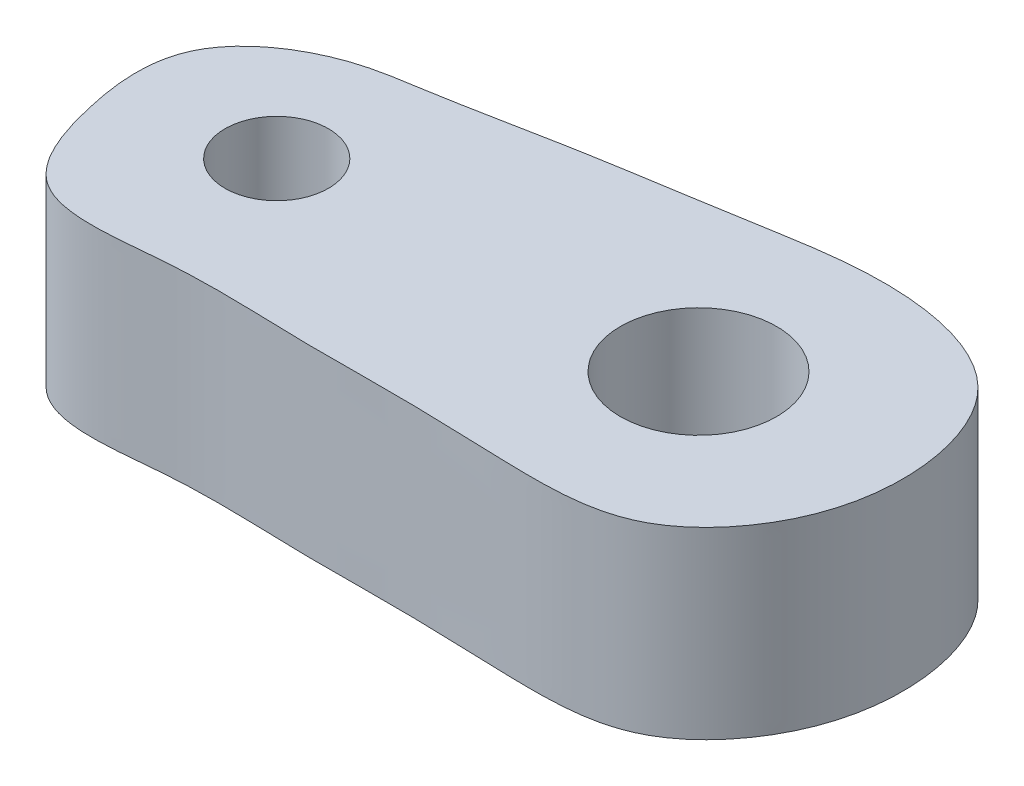
from build123d import *

# Parameters (mm, degrees)
SKETCH1_R           = 1.7
SKETCH1_R_2         = 1.125
BOSS_EXTRUDE4_DEPTH = 4


with BuildPart() as part:
    # Sketch1 → Boss-Extrude4 (new body)
    with BuildSketch(Plane(origin=(0, 0, 0), x_dir=(1, 0, 0), z_dir=(0, 1, 0))):
        with BuildLine():
            add(Edge.make_bspline(
                [(-24.105598553, 68.079736045), (-23.203300365, 68.22763706), (-21.196505696, 68.657065162), (-18.294137467, 69.080253356), (-15.351256217, 69.645359744), (-12.189891612, 69.027624798), (-11.298487188, 66.039813049), (-11.924376267, 63.702720898), (-13.639930098, 61.966009621), (-16.024555432, 61.929568536), (-18.321497485, 62.051455267), (-20.927177877, 61.987522519), (-23.452236285, 62.164112232), (-26.578186239, 61.59863612), (-27.496689817, 64.136041075), (-27.731625039, 66.563960319), (-25.727920045, 67.840979066), (-24.502977026, 68.014599396), (-24.105598553, 68.079736045)],
                knots=[0, 0, 0, 0, 0.06934668, 0.15362161, 0.219474506, 0.299217979, 0.363563538, 0.42728558, 0.475902793, 0.534683362, 0.59677474, 0.652193592, 0.727563232, 0.798163022, 0.849275047, 0.905690836, 0.969459234, 1, 1, 1, 1], degree=3))
        make_face()
        with Locations(Location((-15.793492851, 65.758536314, 0), (0, 0, 270))):
            Circle(SKETCH1_R, mode=Mode.SUBTRACT)
        with Locations(Location((-24.392985186, 65.183763048, 0), (0, 0, 270))):
            Circle(SKETCH1_R_2, mode=Mode.SUBTRACT)
    extrude(amount=BOSS_EXTRUDE4_DEPTH)


solid = part.part
